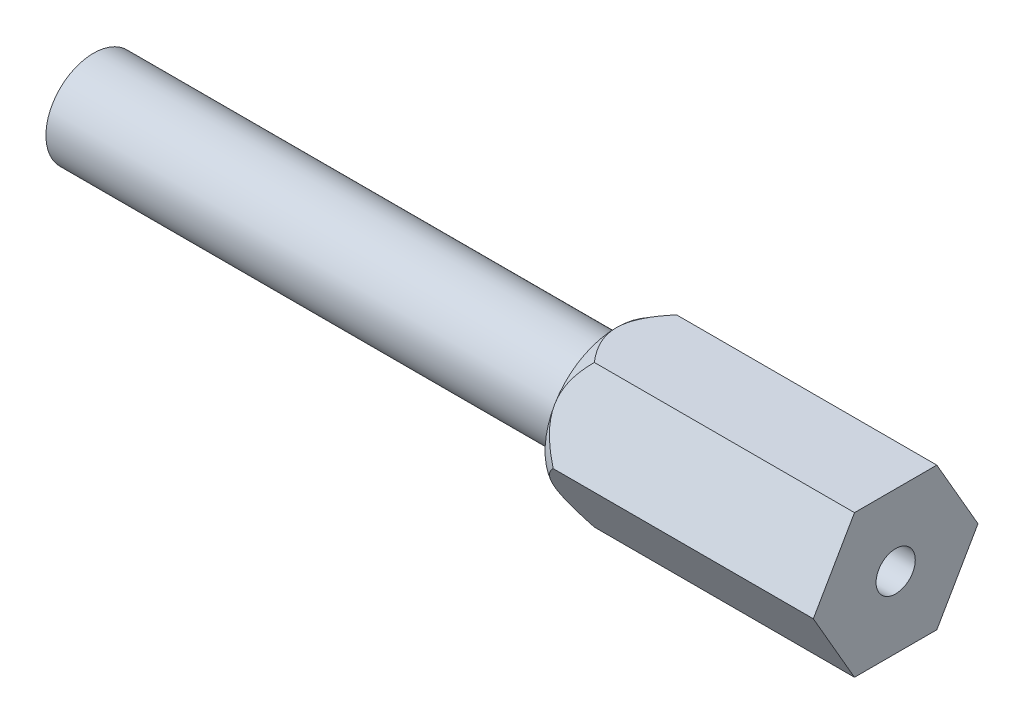
from build123d import *

# Parameters (mm, degrees)
BOSS_EXTRU_1_DEPTH        = 67.5
TROU_TARAUD_M4X0_71_D     = 3.3
TROU_TARAUD_M4X0_71_DEPTH = 15
TROU_TARAUD_M4X0_71_TIP   = 0.991420021
TROU_TARAUD_M3X0_51_D     = 2.5
TROU_TARAUD_M3X0_51_DEPTH = 15
TROU_TARAUD_M3X0_51_TIP   = 0.751075774


with BuildPart() as part:
    # Esquisse1 → Boss.-Extru.1 (new body)
    with BuildSketch(Plane(origin=(0, 0, 0), x_dir=(0, 0, -1), z_dir=(1, 0, 0))):
        Polygon((6.92820323, 0), (3.464101615, 6), (-3.464101615, 6), (-6.92820323, 0), (-3.464101615, -6), (3.464101615, -6), align=None)
    extrude(amount=-BOSS_EXTRU_1_DEPTH)

    # Trou taraudé M4x0.71
    with Locations(Plane(origin=(0, 0, 0), x_dir=(0, 0, -1), z_dir=(1, 0, 0))):
        with Locations((0, 0)):
            Hole(TROU_TARAUD_M4X0_71_D / 2, depth=TROU_TARAUD_M4X0_71_DEPTH)
            with Locations((0, 0, -(TROU_TARAUD_M4X0_71_DEPTH + TROU_TARAUD_M4X0_71_TIP / 2))):  # 118° drill point
                Cone(0, TROU_TARAUD_M4X0_71_D / 2, TROU_TARAUD_M4X0_71_TIP, mode=Mode.SUBTRACT)

    # Trou taraudé M3x0.51
    with Locations(Plane.ZY.offset(67.5)):
        with Locations((0, 0)):
            Hole(TROU_TARAUD_M3X0_51_D / 2, depth=TROU_TARAUD_M3X0_51_DEPTH)
            with Locations((0, 0, -(TROU_TARAUD_M3X0_51_DEPTH + TROU_TARAUD_M3X0_51_TIP / 2))):  # 118° drill point
                Cone(0, TROU_TARAUD_M3X0_51_D / 2, TROU_TARAUD_M3X0_51_TIP, mode=Mode.SUBTRACT)

    # Esquisse4 → Enlèvement de matière-Révolution1 (revolve, cut)
    with BuildSketch(Plane(origin=(0, 0, 0), x_dir=(1, 0, 0), z_dir=(0, 1, 0))):
        Polygon((-21.892304845, 6.92820323), (-67.5, 6.92820323), (-67.5, 4), (-23.5, 4), (-23.5, 6), align=None)
    revolve(axis=Axis((0, 0, 0), (-1, 0, 0)), mode=Mode.SUBTRACT)


solid = part.part
